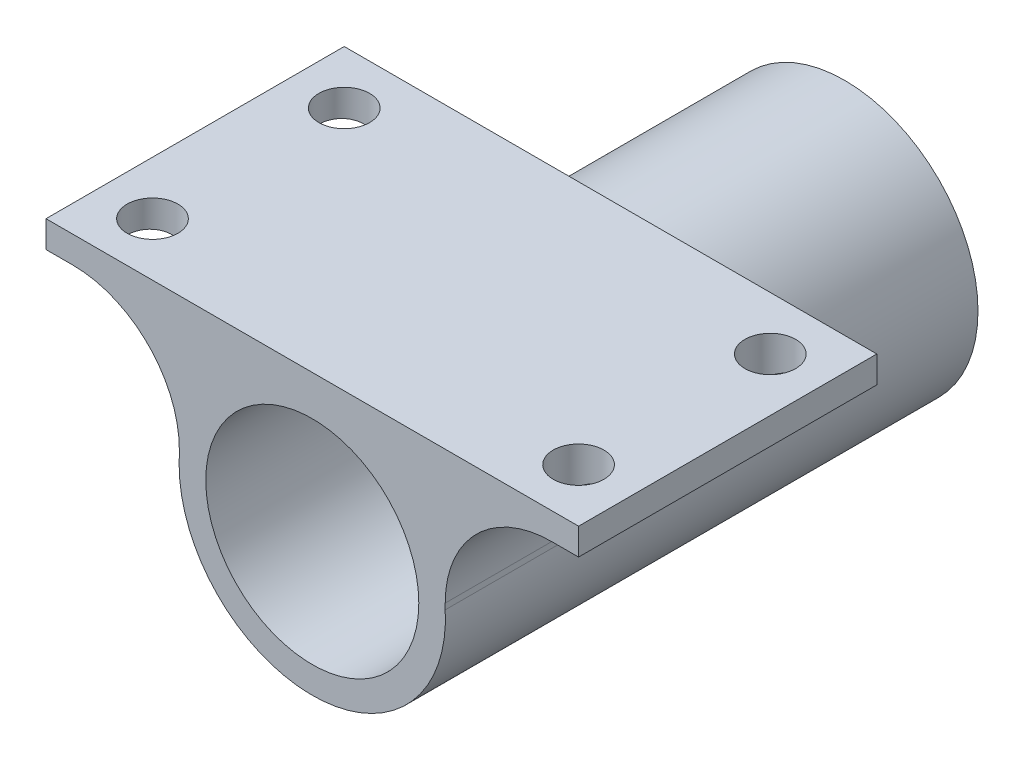
from build123d import *

# Parameters (mm, degrees)
SKETCH1_R           = 10
BOSS_EXTRUDE1_DEPTH = 48
BOSS_EXTRUDE3_START = 2
SKETCH3_R           = 12.5
SKETCH3_R_2         = 3.5
SKETCH3_R_3         = 0.95
BOSS_EXTRUDE3_DEPTH = 2
SKETCH4_R           = 2.38125
CUT_EXTRUDE1_DEPTH  = 61.153219082
SKETCH6_W           = 58.309477214
SKETCH6_H           = 41.572471276
SKETCH6_R           = 12.5
CUT_EXTRUDE4_DEPTH  = 22


with BuildPart() as part:
    # Sketch1 → Boss-Extrude1 (new body)
    with BuildSketch(Plane.XY):
        with BuildLine():
            Line((-25, 13.756613757), (-25, 11.243386243))
            Line((-25, 11.243386243), (-22.480898871, 11.243386243))
            ThreePointArc((-22.480898871, 11.243386243), (-15.409831059, 8.314454055), (-12.480898871, 1.243386243))
            Line((-12.480898871, 1.243386243), (-12.480898871, 0.690770135))
            ThreePointArc((-12.480898871, 0.690770135), (0, -12.5), (12.480898871, 0.690770135))
            Line((12.480898871, 0.690770135), (12.480898871, 1.243386243))
            ThreePointArc((12.480898871, 1.243386243), (15.409831059, 8.314454055), (22.480898871, 11.243386243))
            Line((22.480898871, 11.243386243), (25, 11.243386243))
            Line((25, 11.243386243), (25, 13.756613757))
            Line((25, 13.756613757), (-25, 13.756613757))
        make_face()
        Circle(SKETCH1_R, mode=Mode.SUBTRACT)
    extrude(amount=BOSS_EXTRUDE1_DEPTH)

    # Sketch3 → Boss-Extrude3 (add)
    with BuildSketch(Plane(origin=(0, 0, 0), x_dir=(-1, 0, 0), z_dir=(0, 0, -1)).offset(BOSS_EXTRUDE3_START)):
        Circle(SKETCH3_R)
        Circle(SKETCH3_R_2, mode=Mode.SUBTRACT)
        with Locations((7.5, 0)):
            Circle(SKETCH3_R_3, mode=Mode.SUBTRACT)
        with Locations((-7.5, 0)):
            Circle(SKETCH3_R_3, mode=Mode.SUBTRACT)
    extrude(amount=-BOSS_EXTRUDE3_DEPTH)

    # Sketch4 → Cut-Extrude1 (cut, through all)
    with BuildSketch(Plane(origin=(0, 13.756613757, 0), x_dir=(1, 0, 0), z_dir=(0, 1, 0))):
        with Locations(Location((-20, -25, 0), (0, 0, 270))):
            Circle(SKETCH4_R)
        with Locations(Location((20, -25, 0), (0, 0, 270))):
            Circle(SKETCH4_R)
        with Locations(Location((20, -43, 0), (0, 0, 270))):
            Circle(SKETCH4_R)
        with Locations(Location((-20, -43, 0), (0, 0, 270))):
            Circle(SKETCH4_R)
    extrude(amount=-CUT_EXTRUDE1_DEPTH, mode=Mode.SUBTRACT)

    # Sketch6 → Cut-Extrude4 (cut)
    with BuildSketch(Plane(origin=(0, 0, -2), x_dir=(-1, 0, 0), z_dir=(0, 0, -1))):
        Rectangle(SKETCH6_W, SKETCH6_H)
        Circle(SKETCH6_R, mode=Mode.SUBTRACT)
    extrude(amount=-CUT_EXTRUDE4_DEPTH, mode=Mode.SUBTRACT)


solid = part.part
